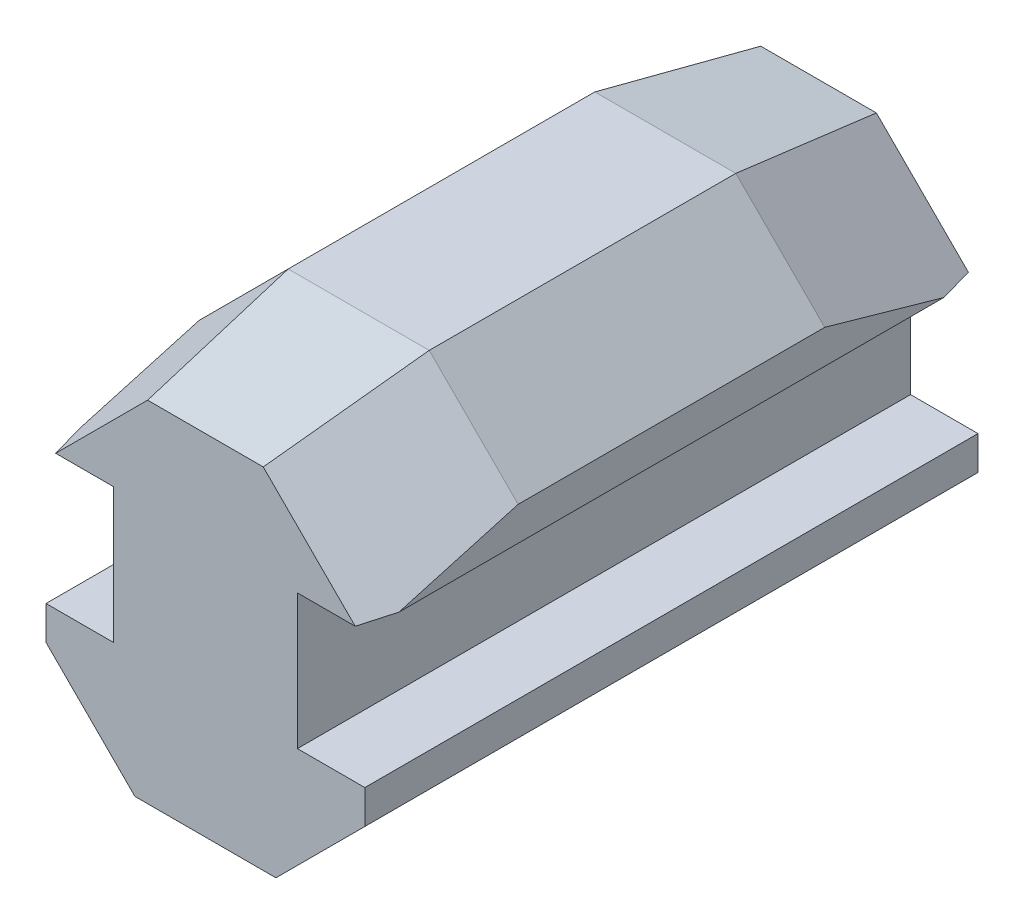
from build123d import *
from OCP.BRepFilletAPI import BRepFilletAPI_MakeChamfer

# Parameters (mm, degrees)
BOSS_EXTRUDE2_DEPTH = 10
CHAMFER1_SIZE       = 5
CHAMFER1_SIZE2      = 1
CHAMFER2_SIZE       = 1
CHAMFER2_SIZE2      = 5


with BuildPart() as part:
    # Sketch2 → Boss-Extrude2 (new, symmetric)
    with BuildSketch(Plane.XY):
        Polygon((5.2, 3.3), (2.3, 6.2), (-2.3, 6.2), (-5.2, 3.3), (-5.2, 2.2), (-3, 2.2), (-3, -2.2), (-5.2, -2.2), (-5.2, -3.3), (-2.3, -6.2), (2.3, -6.2), (5.2, -3.3), (5.2, -2.2), (3, -2.2), (3, 2.2), (5.2, 2.2), align=None)
    extrude(amount=BOSS_EXTRUDE2_DEPTH, both=True)

    # Chamfer1: one chamfer whose edges measure the first distance from different faces: ONE call of the kernel's chamfer builder (chamfer() names one face for all edges)
    chamfer1_edges_1 = [part.edges().sort_by_distance(p)[0] for p in [
        (-3.75, 4.75, 10),
    ]]
    chamfer1_side_1 = [part.faces().sort_by_distance(p)[0] for p in [
        (-3.75, 4.75, 0),
    ]]
    chamfer1_edges_2 = [part.edges().sort_by_distance(p)[0] for p in [
        (3.75, 4.75, 10),
    ]]
    chamfer1_side_2 = [part.faces().sort_by_distance(p)[0] for p in [
        (3.75, 4.75, 0),
    ]]
    chamfer1_edges_3 = [part.edges().sort_by_distance(p)[0] for p in [
        (0, 6.2, 10),
    ]]
    chamfer1_side_3 = [part.faces().sort_by_distance(p)[0] for p in [
        (0, 6.2, 0),
    ]]
    chamfer1 = BRepFilletAPI_MakeChamfer(part.part.solid().wrapped)
    for e in chamfer1_edges_1:
        chamfer1.Add(CHAMFER1_SIZE, CHAMFER1_SIZE2, e.wrapped, chamfer1_side_1[0].wrapped)  # the first distance lies on this face
    for e in chamfer1_edges_2:
        chamfer1.Add(CHAMFER1_SIZE, CHAMFER1_SIZE2, e.wrapped, chamfer1_side_2[0].wrapped)  # the first distance lies on this face
    for e in chamfer1_edges_3:
        chamfer1.Add(CHAMFER1_SIZE, CHAMFER1_SIZE2, e.wrapped, chamfer1_side_3[0].wrapped)  # the first distance lies on this face
    add(Compound.cast(chamfer1.Shape()), mode=Mode.REPLACE)

    # Chamfer2
    chamfer2_edges = [part.edges().sort_by_distance(p)[0] for p in [
        (-3.75, 4.75, -10),
        (0, 6.2, -10),
        (3.75, 4.75, -10),
    ]]
    chamfer2_side = [part.faces().sort_by_distance(p)[0] for p in [
        (0, 0, -10),
    ]]
    chamfer(chamfer2_edges, length=CHAMFER2_SIZE, length2=CHAMFER2_SIZE2, reference=chamfer2_side[0])


solid = part.part
